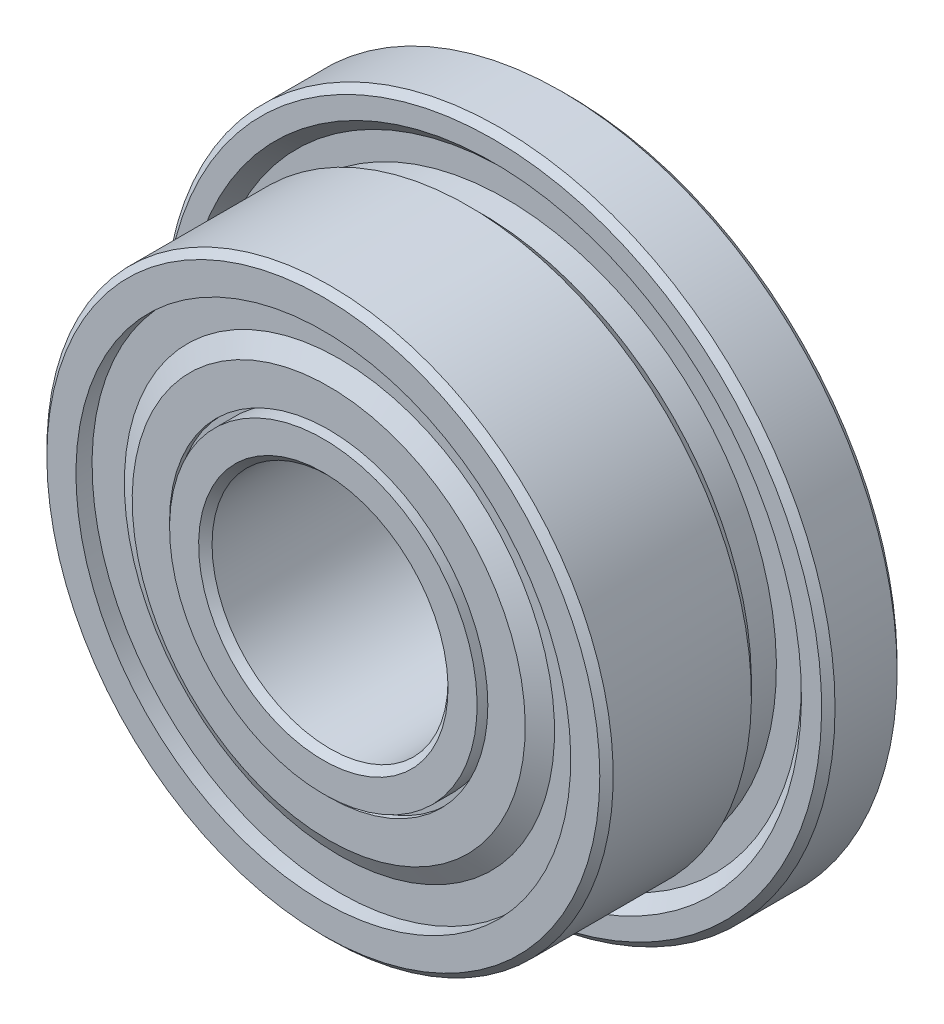
from build123d import *

# Parameters (mm, degrees)
FILLET1_SIZE      = 0.07109375
FILLET2_SIZE      = 0.07109375
CIRPATTERN3_COUNT = 13
SKETCH8_W         = 0.2275
SKETCH8_H         = 0.189583333


with BuildPart() as part:
    # Sketch2 → Revolve1 (revolve)
    with BuildSketch(Plane(origin=(0, 0, 0), x_dir=(0, 0, -1), z_dir=(1, 0, 0)), mode=Mode.PRIVATE) as revolve1_sk:
        with BuildLine():
            Line((1.3, 3.55), (0.5, 3.55))
            Line((0.5, 3.55), (0.5, 3.265165043))
            Line((0.5, 3.265165043), (0.632582521, 3.132582521))
            Line((0.632582521, 3.132582521), (0.632582521, 2.867417479))
            Line((0.632582521, 2.867417479), (0.367417479, 2.867417479))
            Line((0.367417479, 2.867417479), (0.234834957, 3))
            Line((0.234834957, 3), (-1.3, 3))
            Line((-1.3, 3), (-1.3, 2.43125))
            Line((-1.3, 2.43125), (-0.257314861, 2.43125))
            ThreePointArc((-0.257314861, 2.43125), (0, 2.525), (0.257314861, 2.43125))
            Line((0.257314861, 2.43125), (1.3, 2.43125))
            Line((1.3, 2.43125), (1.3, 3.55))
        make_face()
        with BuildLine():
            Line((1.3, 1.25), (-1.3, 1.25))
            Line((-1.3, 1.25), (-1.3, 1.81875))
            Line((-1.3, 1.81875), (-0.257314861, 1.81875))
            ThreePointArc((-0.257314861, 1.81875), (0, 1.725), (0.257314861, 1.81875))
            Line((0.257314861, 1.81875), (1.3, 1.81875))
            Line((1.3, 1.81875), (1.3, 1.25))
        make_face()
    revolve(revolve1_sk.sketch.rotate(Axis((0, 0, 0), (0, 0, -1)), 180), axis=Axis((0, 0, 0), (0, 0, -1)))

    # Fillet1
    fillet1_edges = [part.edges().sort_by_distance(p)[0] for p in [
        (0, 3, 1.3),
        (0, 3.55, -1.3),
        (0, 3.55, -0.5),
    ]]
    chamfer(fillet1_edges, length=FILLET1_SIZE)

    # Fillet2
    fillet2_edges = [part.edges().sort_by_distance(p)[0] for p in [
        (0, 1.25, -1.3),
        (0, 1.25, 1.3),
    ]]
    chamfer(fillet2_edges, length=FILLET2_SIZE)

    # Sketch8 → Cut-Revolve1 (revolve, cut)
    with BuildSketch(Plane(origin=(0, 0, 0), x_dir=(0, 0, -1), z_dir=(1, 0, 0)), mode=Mode.PRIVATE) as cut_revolve1_sk:
        with Locations((-1.18625, 2.526041667)):
            Rectangle(SKETCH8_W, SKETCH8_H)
        with Locations((1.18625, 2.526041667)):
            Rectangle(SKETCH8_W, SKETCH8_H)
        with Locations((1.18625, 1.723958334)):
            Rectangle(SKETCH8_W, SKETCH8_H)
        with Locations((-1.18625, 1.723958334)):
            Rectangle(SKETCH8_W, SKETCH8_H)
    revolve(cut_revolve1_sk.sketch.rotate(Axis((0, 0, 0), (0, 0, -1)), 180), axis=Axis((0, 0, 0), (0, 0, -1)), mode=Mode.SUBTRACT)


with BuildPart() as body_2:
    # Sketch7 → Revolve3 (revolve)
    with BuildSketch(Plane.XY):
        with BuildLine():
            Line((0, 2.525), (0, 1.725))
            ThreePointArc((0, 1.725), (-0.4, 2.125), (0, 2.525))
        make_face()
    revolve(axis=Axis((0, 2.525, 0), (0, -1, 0)))


with BuildPart() as cirpattern3_1:
    # CirPattern3: pattern copy
    add(body_2.part.rotate(Axis((0, 0, 0), (0, 0, 1)), 1 * 360 / CIRPATTERN3_COUNT))


with BuildPart() as cirpattern3_2:
    # CirPattern3: pattern copy
    add(body_2.part.rotate(Axis((0, 0, 0), (0, 0, 1)), 2 * 360 / CIRPATTERN3_COUNT))


with BuildPart() as cirpattern3_3:
    # CirPattern3: pattern copy
    add(body_2.part.rotate(Axis((0, 0, 0), (0, 0, 1)), 3 * 360 / CIRPATTERN3_COUNT))


with BuildPart() as cirpattern3_4:
    # CirPattern3: pattern copy
    add(body_2.part.rotate(Axis((0, 0, 0), (0, 0, 1)), 4 * 360 / CIRPATTERN3_COUNT))


with BuildPart() as cirpattern3_5:
    # CirPattern3: pattern copy
    add(body_2.part.rotate(Axis((0, 0, 0), (0, 0, 1)), 5 * 360 / CIRPATTERN3_COUNT))


with BuildPart() as cirpattern3_6:
    # CirPattern3: pattern copy
    add(body_2.part.rotate(Axis((0, 0, 0), (0, 0, 1)), 6 * 360 / CIRPATTERN3_COUNT))


with BuildPart() as cirpattern3_7:
    # CirPattern3: pattern copy
    add(body_2.part.rotate(Axis((0, 0, 0), (0, 0, 1)), 7 * 360 / CIRPATTERN3_COUNT))


with BuildPart() as cirpattern3_8:
    # CirPattern3: pattern copy
    add(body_2.part.rotate(Axis((0, 0, 0), (0, 0, 1)), 8 * 360 / CIRPATTERN3_COUNT))


with BuildPart() as cirpattern3_9:
    # CirPattern3: pattern copy
    add(body_2.part.rotate(Axis((0, 0, 0), (0, 0, 1)), 9 * 360 / CIRPATTERN3_COUNT))


with BuildPart() as cirpattern3_10:
    # CirPattern3: pattern copy
    add(body_2.part.rotate(Axis((0, 0, 0), (0, 0, 1)), 10 * 360 / CIRPATTERN3_COUNT))


with BuildPart() as cirpattern3_11:
    # CirPattern3: pattern copy
    add(body_2.part.rotate(Axis((0, 0, 0), (0, 0, 1)), 11 * 360 / CIRPATTERN3_COUNT))


with BuildPart() as cirpattern3_12:
    # CirPattern3: pattern copy
    add(body_2.part.rotate(Axis((0, 0, 0), (0, 0, 1)), 12 * 360 / CIRPATTERN3_COUNT))


with BuildPart() as body_15:
    # Sketch9 → Revolve4 (revolve)
    with BuildSketch(Plane(origin=(0, 0, 0), x_dir=(0, 0, -1), z_dir=(1, 0, 0)), mode=Mode.PRIVATE) as revolve4_sk:
        Polygon((-1.0725, 2.620833333), (-1.0725, 2.263690476), (-1.18625, 2.066669697), (-1.18625, 1.686041667), (-1.243125, 1.686041667), (-1.243125, 2.081909307), (-1.129375, 2.278930087), (-1.129375, 2.620833333), align=None)
        Polygon((1.0725, 2.620833333), (1.0725, 2.263690476), (1.18625, 2.066669697), (1.18625, 1.686041667), (1.243125, 1.686041667), (1.243125, 2.081909307), (1.129375, 2.278930087), (1.129375, 2.620833333), align=None)
    revolve(revolve4_sk.sketch.rotate(Axis((0, 0, 0), (0, 0, -1)), 180), axis=Axis((0, 0, 0), (0, 0, -1)))


solid = Compound([part.part, body_2.part, cirpattern3_1.part, cirpattern3_2.part, cirpattern3_3.part, cirpattern3_4.part, cirpattern3_5.part, cirpattern3_6.part, cirpattern3_7.part, cirpattern3_8.part, cirpattern3_9.part, cirpattern3_10.part, cirpattern3_11.part, cirpattern3_12.part, body_15.part])
